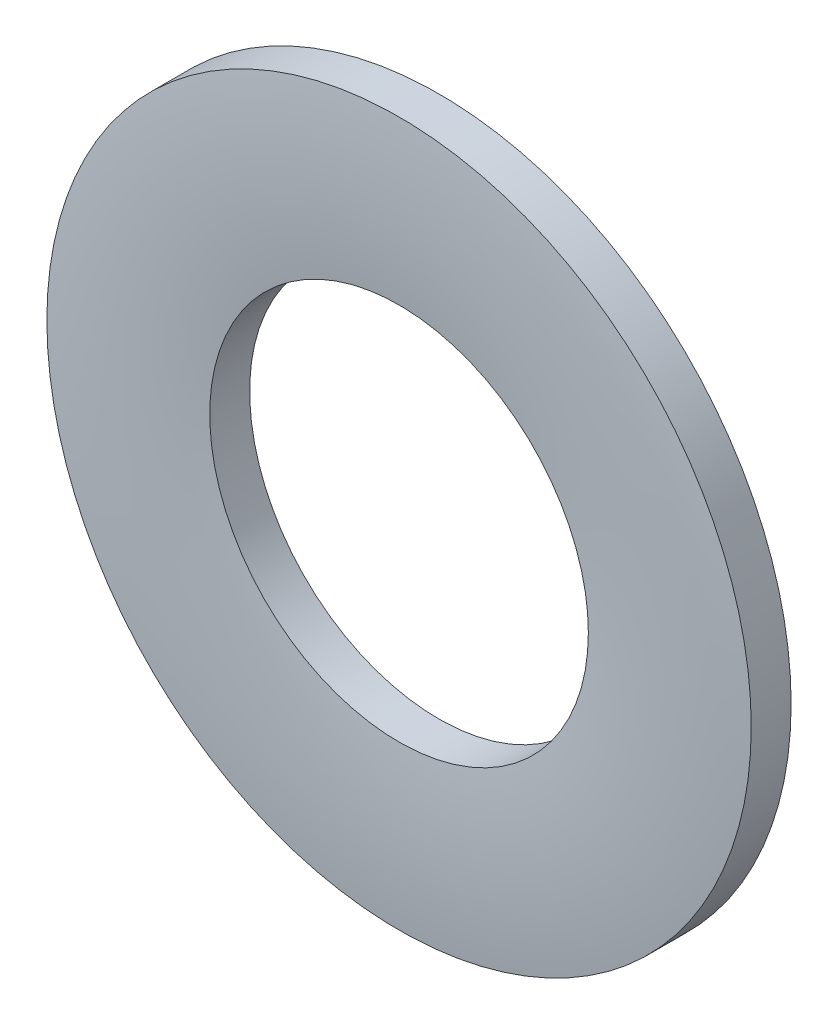
from build123d import *


with BuildPart() as part:
    # Sketch3 → Revolve1 (revolve)
    with BuildSketch(Plane(origin=(0, 0, 0), x_dir=(0, 0, -1), z_dir=(1, 0, 0)), mode=Mode.PRIVATE) as revolve1_sk:
        with BuildLine():
            Line((0.25, 4), (-0.20315, 4))
            ThreePointArc((-0.20315, 4), (-0.25, 3.075), (-0.20315, 2.15))
            Line((-0.20315, 2.15), (0.25, 2.15))
            Line((0.25, 2.15), (0.25, 4))
        make_face()
    revolve(revolve1_sk.sketch.rotate(Axis((0, 0, 0.25), (0, 0, -1)), 90), axis=Axis((0, 0, 0.25), (0, 0, -1)))


solid = part.part
